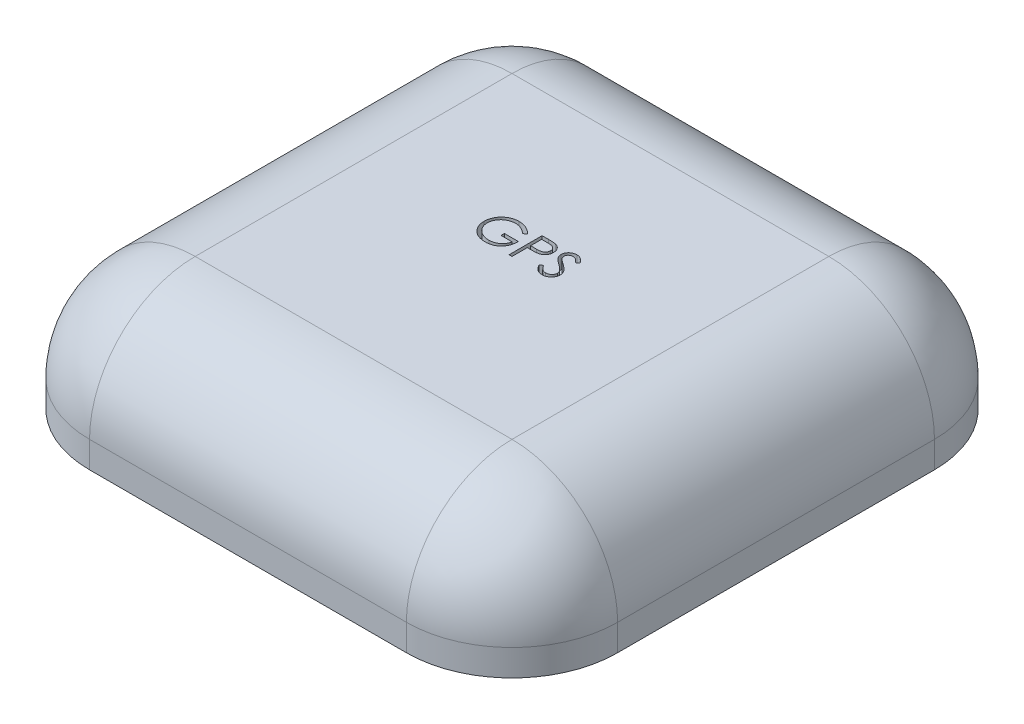
from build123d import *

# Parameters (mm, degrees)
SKETCH1_W           = 50.8
SKETCH1_H           = 50.8
BOSS_EXTRUDE1_DEPTH = 12.7
FILLET1_R           = 10.16
CUT_EXTRUDE1_DEPTH  = 1.27


with BuildPart() as part:
    # Sketch1 → Boss-Extrude1 (new body)
    with BuildSketch(Plane(origin=(0, 0, 0), x_dir=(1, 0, 0), z_dir=(0, 1, 0))):
        Rectangle(SKETCH1_W, SKETCH1_H)
    extrude(amount=BOSS_EXTRUDE1_DEPTH)

    # Fillet1
    fillet1_edges = [part.edges().sort_by_distance(p)[0] for p in [
        (-25.4, 12.7, 0),
        (0, 12.7, 25.4),
        (25.4, 12.7, 0),
        (0, 12.7, -25.4),
        (25.4, 6.35, 25.4),
        (-25.4, 6.35, 25.4),
        (-25.4, 6.35, -25.4),
        (25.4, 6.35, -25.4),
    ]]
    fillet(fillet1_edges, radius=FILLET1_R)

    # Sketch2 → Cut-Extrude1 (cut)
    # profile 1 of 3: a face of its own
    with BuildSketch(Plane(origin=(0, 12.7, 0), x_dir=(1, 0, 0), z_dir=(0, 1, 0))):
        with BuildLine():
            Line((-1.135791938, 2.633112981), (-1.380022707, 2.401602564))
            add(Edge.make_bspline(
                [(-1.380022707, 2.401602564), (-1.424217699, 2.443177704), (-1.511553827, 2.525336601), (-1.65393919, 2.631935861), (-1.802496201, 2.723254395), (-1.95644968, 2.797555052), (-2.111987082, 2.856839342), (-2.267043901, 2.899047012), (-2.420029644, 2.925964242), (-2.521781335, 2.92918312), (-2.571919743, 2.930769231)],
                knots=[0, 0, 0, 0, 1.08915593, 2.152340314, 3.188132944, 4.216796309, 5.218260357, 6.173443236, 7.099959455, 8, 8, 8, 8], degree=3))
            add(Edge.make_bspline(
                [(-2.571919743, 2.930769231), (-2.60268522, 2.930394031), (-2.664136384, 2.929644605), (-2.755414862, 2.920079495), (-2.845736026, 2.906322797), (-2.934929373, 2.88641838), (-3.023168326, 2.86119159), (-3.110145992, 2.829636205), (-3.196024621, 2.792846805), (-3.27999528, 2.750335847), (-3.361402737, 2.703636272), (-3.438289295, 2.651885096), (-3.511145021, 2.596740979), (-3.57860055, 2.536823305), (-3.641043898, 2.47267482), (-3.69996135, 2.405488821), (-3.753280754, 2.33342973), (-3.801442025, 2.257823341), (-3.844405779, 2.179997569), (-3.8823322, 2.1007015), (-3.914170273, 2.020198146), (-3.939361136, 1.93838649), (-3.960144372, 1.855899455), (-3.974765344, 1.772165887), (-3.983008299, 1.687096129), (-3.984434128, 1.630130045), (-3.985150913, 1.601492388)],
                knots=[0, 0, 0, 0, 1.02818874, 2.053710826, 3.065248034, 4.081641283, 5.106893873, 6.131558223, 7.173050175, 8.228653731, 9.27666206, 10.308777013, 11.325269123, 12.329503258, 13.32196095, 14.316845687, 15.314881793, 16.315733098, 17.311955233, 18.285320748, 19.252783886, 20.203351036, 21.145449891, 22.095197417, 23.042428769, 24, 24, 24, 24], degree=3))
            add(Edge.make_bspline(
                [(-3.985150913, 1.601492388), (-3.984465368, 1.572218146), (-3.983096151, 1.513749602), (-3.974332861, 1.426487836), (-3.958069386, 1.340522078), (-3.93632725, 1.255569843), (-3.909130367, 1.17148564), (-3.87522802, 1.088634006), (-3.835072797, 1.007018008), (-3.788593925, 0.927373027), (-3.737625012, 0.849791427), (-3.680526645, 0.776712433), (-3.619874545, 0.707162899), (-3.553459078, 0.642687027), (-3.483409922, 0.581560207), (-3.407634215, 0.525466555), (-3.327621983, 0.473325596), (-3.243251155, 0.425794467), (-3.155437202, 0.383332438), (-3.065397148, 0.345573618), (-2.972843343, 0.314477362), (-2.878262189, 0.289133511), (-2.781766436, 0.26835967), (-2.682866272, 0.254995206), (-2.582288886, 0.245297095), (-2.51449027, 0.244588008), (-2.480333204, 0.244230769)],
                knots=[0, 0, 0, 0, 0.93586088, 1.869166235, 2.799637598, 3.729985548, 4.670839027, 5.622275134, 6.589130586, 7.576015415, 8.568469353, 9.55398029, 10.53834874, 11.515998671, 12.510579167, 13.508179873, 14.527009472, 15.561807829, 16.601455013, 17.643573243, 18.680854198, 19.719860599, 20.772568776, 21.833555941, 22.908541556, 24, 24, 24, 24], degree=3))
            add(Edge.make_bspline(
                [(-2.480333204, 0.244230769), (-2.439168561, 0.245091263), (-2.358335095, 0.246780984), (-2.239511679, 0.259934818), (-2.125390322, 0.280478695), (-2.016291695, 0.310564901), (-1.912089083, 0.348940378), (-1.812400487, 0.395200478), (-1.718010768, 0.451119539), (-1.628636175, 0.514232975), (-1.546306442, 0.584550002), (-1.472053058, 0.660427472), (-1.407060364, 0.741497075), (-1.350359673, 0.827281326), (-1.303452536, 0.918490281), (-1.264950858, 1.014676963), (-1.235438515, 1.115884634), (-1.223323645, 1.185817757), (-1.217202195, 1.221153846)],
                knots=[0, 0, 0, 0, 1.13008108, 2.219097802, 3.278683437, 4.311054135, 5.322181354, 6.324827112, 7.324222904, 8.330512327, 9.32562643, 10.293043162, 11.24128371, 12.174520618, 13.111833804, 14.052305215, 15.015860969, 16, 16, 16, 16], degree=3))
            Line((-1.217202195, 1.221153846), (-2.275535528, 1.221153846))
            Line((-2.275535528, 1.221153846), (-2.275535528, 1.546794872))
            Line((-2.275535528, 1.546794872), (-0.932266297, 1.546794872))
            add(Edge.make_bspline(
                [(-0.932266297, 1.546794872), (-0.933813745, 1.486100221), (-0.936842381, 1.367309826), (-0.958086683, 1.194072509), (-0.992391662, 1.030449616), (-1.039254945, 0.876268829), (-1.099920378, 0.731748642), (-1.173736886, 0.59674232), (-1.261885881, 0.472122045), (-1.361227496, 0.356870449), (-1.472715315, 0.254064664), (-1.593336849, 0.163707849), (-1.723291384, 0.087596191), (-1.862455995, 0.025674018), (-2.010375103, -0.022653106), (-2.16739099, -0.056917322), (-2.333290728, -0.077445931), (-2.446988999, -0.080068825), (-2.505137892, -0.081410256)],
                knots=[0, 0, 0, 0, 1.140356446, 2.231883559, 3.274166699, 4.278491846, 5.25512956, 6.21435461, 7.1637429, 8.11826594, 9.068280886, 10.0076534, 10.945064095, 11.891975133, 12.864533718, 13.863980011, 14.907571808, 16, 16, 16, 16], degree=3))
            add(Edge.make_bspline(
                [(-2.505137892, -0.081410256), (-2.540979229, -0.080893982), (-2.611669897, -0.079875723), (-2.71607381, -0.072639129), (-2.81759908, -0.061498892), (-2.916230917, -0.044675816), (-3.012332127, -0.02407038), (-3.105422751, 0.00231543), (-3.195857403, 0.03285775), (-3.283775861, 0.067597396), (-3.368380128, 0.107848828), (-3.45004704, 0.152579715), (-3.529228026, 0.201559407), (-3.605383725, 0.25563496), (-3.678910939, 0.314401906), (-3.749335563, 0.377978032), (-3.817051852, 0.446168976), (-3.859470273, 0.494591364), (-3.880844022, 0.518990385)],
                knots=[0, 0, 0, 0, 1.107784379, 2.184907829, 3.233506516, 4.263428166, 5.276301166, 6.270063455, 7.25232949, 8.225834625, 9.190232166, 10.146266622, 11.1027726, 12.066435141, 13.031522626, 14.010570082, 14.99756817, 16, 16, 16, 16], degree=3))
            add(Edge.make_bspline(
                [(-3.880844022, 0.518990385), (-3.911855546, 0.557698763), (-3.973363834, 0.634473), (-4.05253759, 0.757481521), (-4.120030292, 0.884846065), (-4.17479253, 1.016921192), (-4.217553509, 1.153583364), (-4.248220609, 1.29465795), (-4.26618865, 1.440326615), (-4.268777216, 1.538901533), (-4.27008681, 1.588772035)],
                knots=[0, 0, 0, 0, 1.023165419, 2.029347347, 3.013907458, 3.994755782, 4.975994455, 5.96558838, 6.970761222, 8, 8, 8, 8], degree=3))
            add(Edge.make_bspline(
                [(-4.27008681, 1.588772035), (-4.269603994, 1.626115707), (-4.268644498, 1.700328436), (-4.257009923, 1.810507565), (-4.240317208, 1.918730336), (-4.215781666, 2.024908283), (-4.184851483, 2.12911232), (-4.146249392, 2.23139083), (-4.101305093, 2.331804171), (-4.049066822, 2.42966118), (-3.990933062, 2.523663326), (-3.927841076, 2.61343219), (-3.858894953, 2.697332985), (-3.785220621, 2.776428266), (-3.705939066, 2.849724363), (-3.621793017, 2.917899877), (-3.532717627, 2.98104626), (-3.438432664, 3.038168896), (-3.340345407, 3.08948018), (-3.238690978, 3.134464679), (-3.133500406, 3.171642401), (-3.025561765, 3.203187187), (-2.914058032, 3.226514493), (-2.799798367, 3.243431569), (-2.682187194, 3.255007256), (-2.602688796, 3.255938217), (-2.562379478, 3.256410256)],
                knots=[0, 0, 0, 0, 1.008945113, 2.00506715, 2.99143336, 3.967273523, 4.948097931, 5.927297278, 6.919902385, 7.919676788, 8.923139349, 9.905703106, 10.883022732, 11.856032218, 12.825136022, 13.798837087, 14.781400844, 15.773989409, 16.776158564, 17.77167057, 18.775803737, 19.789618931, 20.80898985, 21.851988756, 22.910860228, 24, 24, 24, 24], degree=3))
            add(Edge.make_bspline(
                [(-2.562379478, 3.256410256), (-2.529506214, 3.255884575), (-2.464322395, 3.254842209), (-2.367325481, 3.247617136), (-2.271827817, 3.236165472), (-2.177687807, 3.220538316), (-2.085226032, 3.199253397), (-1.994179092, 3.173782381), (-1.904415005, 3.144126228), (-1.816215093, 3.108757774), (-1.728986308, 3.068613415), (-1.642243639, 3.023425524), (-1.556283466, 2.972421413), (-1.470956718, 2.915449634), (-1.385725333, 2.853488677), (-1.301937407, 2.784766415), (-1.217570451, 2.711992915), (-1.163321662, 2.659666934), (-1.135791938, 2.633112981)],
                knots=[0, 0, 0, 0, 0.985871117, 1.954866573, 2.915460327, 3.869826059, 4.81536089, 5.759505086, 6.70452669, 7.649098992, 8.607881297, 9.583363685, 10.581137262, 11.603961102, 12.659522466, 13.73993555, 14.853081303, 16, 16, 16, 16], degree=3))
        make_face()
    # profile 2 of 3: a face of its own
    with BuildSketch(Plane(origin=(0, 12.7, 0), x_dir=(1, 0, 0), z_dir=(0, 1, 0))):
        with BuildLine():
            Line((-0.280984246, 3.175), (0.341677012, 3.175))
            add(Edge.make_bspline(
                [(0.341677012, 3.175), (0.384504048, 3.174952923), (0.466562552, 3.17486272), (0.584232638, 3.172127915), (0.691102895, 3.16847513), (0.786942883, 3.163411556), (0.872047486, 3.157427506), (0.946031608, 3.149034585), (1.009476777, 3.140271317), (1.047491913, 3.131361898), (1.064829055, 3.127298678)],
                knots=[0, 0, 0, 0, 1.415646017, 2.712440637, 3.8905458, 4.950247383, 5.884950622, 6.709939814, 7.411656543, 8, 8, 8, 8], degree=3))
            add(Edge.make_bspline(
                [(1.064829055, 3.127298678), (1.086776047, 3.121291623), (1.130152876, 3.109419063), (1.192655965, 3.085639471), (1.252122668, 3.057443507), (1.30875701, 3.025308933), (1.361863043, 2.987857028), (1.412233094, 2.946605961), (1.459422648, 2.900603324), (1.503166339, 2.850365081), (1.543338977, 2.796734605), (1.577928046, 2.738911296), (1.606890602, 2.677868471), (1.631731141, 2.613648589), (1.649609525, 2.545712367), (1.663077784, 2.474531849), (1.67162636, 2.400114666), (1.672445113, 2.349260357), (1.672861908, 2.323372396)],
                knots=[0, 0, 0, 0, 0.999701418, 1.975846123, 2.934577507, 3.890451536, 4.834027766, 5.787354733, 6.749476667, 7.726910423, 8.712836071, 9.690891519, 10.682875813, 11.679750201, 12.712814741, 13.765529915, 14.8625177, 16, 16, 16, 16], degree=3))
            add(Edge.make_bspline(
                [(1.672861908, 2.323372396), (1.672479616, 2.297266841), (1.671731635, 2.24618956), (1.66275429, 2.171465674), (1.650661902, 2.100056849), (1.632068147, 2.032121418), (1.607715287, 1.968062827), (1.579147496, 1.906902138), (1.544691008, 1.849679864), (1.505098912, 1.796188264), (1.46105568, 1.74637713), (1.412747658, 1.700607423), (1.360369871, 1.659147059), (1.304088779, 1.62190309), (1.243355702, 1.589739179), (1.179091749, 1.560930767), (1.110738338, 1.536736305), (1.063437629, 1.524009035), (1.03938835, 1.517538061)],
                knots=[0, 0, 0, 0, 1.121902311, 2.195077645, 3.232258892, 4.234102512, 5.217864754, 6.176164875, 7.132989551, 8.084763148, 9.034132444, 9.988522005, 10.94243251, 11.903244335, 12.886203696, 13.894208494, 14.929344452, 16, 16, 16, 16], degree=3))
            add(Edge.make_bspline(
                [(1.03938835, 1.517538061), (1.019497126, 1.513308071), (0.975904351, 1.504037802), (0.904110596, 1.493688702), (0.820521567, 1.484855307), (0.725251356, 1.478232132), (0.618385478, 1.472562155), (0.499866123, 1.468055384), (0.369460639, 1.465579017), (0.278500296, 1.465451298), (0.231009945, 1.465384615)],
                knots=[0, 0, 0, 0, 0.601384939, 1.31797006, 2.144135048, 3.087295005, 4.142315834, 5.309527816, 6.595305764, 8, 8, 8, 8], degree=3))
            Line((0.231009945, 1.465384615), (0.003951652, 1.465384615))
            Line((0.003951652, 1.465384615), (0.003951652, 0))
            Line((0.003951652, 0), (-0.280984246, 0))
            Line((-0.280984246, 0), (-0.280984246, 3.175))
        make_face()
        with BuildLine():
            Line((0.003951652, 2.849358974), (0.003951652, 1.791025641))
            Line((0.003951652, 1.791025641), (0.559831059, 1.784029447))
            add(Edge.make_bspline(
                [(0.559831059, 1.784029447), (0.586972706, 1.784015419), (0.639369096, 1.783988339), (0.715057669, 1.787603506), (0.785278952, 1.791776847), (0.849817245, 1.797887291), (0.908701643, 1.806524432), (0.962030329, 1.815243652), (1.009389793, 1.827857802), (1.064815498, 1.8448423), (1.12657682, 1.873809745), (1.193766668, 1.915855716), (1.250708557, 1.969450359), (1.299983012, 2.029709891), (1.339086201, 2.096746959), (1.367711994, 2.16847378), (1.384531472, 2.244154758), (1.386786805, 2.295941855), (1.387926011, 2.322100361)],
                knots=[0, 0, 0, 0, 1.160613943, 2.240541288, 3.23993089, 4.169200891, 5.011653406, 5.7853311, 6.478053781, 7.106038997, 8.262395093, 9.384106736, 10.481365981, 11.59014053, 12.70357646, 13.786202915, 14.881775077, 16, 16, 16, 16], degree=3))
            add(Edge.make_bspline(
                [(1.387926011, 2.322100361), (1.38678061, 2.347626012), (1.384503695, 2.398367848), (1.367580162, 2.472734295), (1.339141856, 2.543705256), (1.299720516, 2.609902269), (1.251876777, 2.669944969), (1.196269516, 2.722103078), (1.133029629, 2.764032765), (1.074203019, 2.791095813), (1.021950515, 2.80761967), (0.97656438, 2.819181061), (0.925319268, 2.82841179), (0.868198496, 2.835886196), (0.805644797, 2.842284693), (0.737120754, 2.846626258), (0.662885949, 2.849167579), (0.611350646, 2.849293631), (0.584635746, 2.849358974)],
                knots=[0, 0, 0, 0, 1.120700087, 2.227813068, 3.331159281, 4.466773991, 5.599788987, 6.693661531, 7.80175334, 8.91857717, 9.525282508, 10.207424825, 10.974604443, 11.810962634, 12.737642355, 13.736264703, 14.826523623, 16, 16, 16, 16], degree=3))
            Line((0.584635746, 2.849358974), (0.003951652, 2.849358974))
        make_face(mode=Mode.SUBTRACT)
    # profile 3 of 3: a face of its own
    with BuildSketch(Plane(origin=(0, 12.7, 0), x_dir=(1, 0, 0), z_dir=(0, 1, 0))):
        with BuildLine():
            Line((1.998502934, 0.612484976), (2.266902373, 0.773397436))
            add(Edge.make_bspline(
                [(2.266902373, 0.773397436), (2.291865345, 0.731610458), (2.339693437, 0.651548221), (2.419477884, 0.543364142), (2.502148453, 0.451414185), (2.588317349, 0.376233263), (2.677458602, 0.317043201), (2.770154136, 0.275131177), (2.866091579, 0.24899097), (2.931382117, 0.245815892), (2.963977693, 0.244230769)],
                knots=[0, 0, 0, 0, 1.272034388, 2.437168799, 3.508375237, 4.49857839, 5.41946034, 6.295179144, 7.148887113, 8, 8, 8, 8], degree=3))
            add(Edge.make_bspline(
                [(2.963977693, 0.244230769), (2.99181506, 0.245006079), (3.047002704, 0.246543133), (3.128248453, 0.261312147), (3.207153373, 0.284001721), (3.282091209, 0.316496423), (3.352027945, 0.355810621), (3.413356876, 0.403296082), (3.46637585, 0.456460283), (3.509745547, 0.515771691), (3.543019579, 0.57955939), (3.568593812, 0.645033288), (3.582786129, 0.713221918), (3.584924041, 0.759132838), (3.586002934, 0.782301683)],
                knots=[0, 0, 0, 0, 1.095163259, 2.171163733, 3.241058638, 4.321873601, 5.38011039, 6.391990106, 7.366004449, 8.327778327, 9.272591725, 10.192022065, 11.087607919, 12, 12, 12, 12], degree=3))
            add(Edge.make_bspline(
                [(3.586002934, 0.782301683), (3.584665523, 0.808736596), (3.581946763, 0.862474913), (3.558967492, 0.941758884), (3.522818532, 1.020220001), (3.489469563, 1.068753292), (3.472155778, 1.093950321)],
                knots=[0, 0, 0, 0, 0.938893495, 1.908633276, 2.914225137, 4, 4, 4, 4], degree=3))
            add(Edge.make_bspline(
                [(3.472155778, 1.093950321), (3.457940292, 1.112135653), (3.428096658, 1.150313485), (3.376790915, 1.207141663), (3.316587368, 1.2657598), (3.249546286, 1.32840623), (3.173225556, 1.392167303), (3.090015596, 1.460083527), (2.997791953, 1.5295721), (2.933113124, 1.576174356), (2.899739913, 1.600220353)],
                knots=[0, 0, 0, 0, 0.722233717, 1.516239348, 2.393582979, 3.351407094, 4.387010283, 5.505090956, 6.712668013, 8, 8, 8, 8], degree=3))
            add(Edge.make_bspline(
                [(2.899739913, 1.600220353), (2.866335288, 1.624013428), (2.802468188, 1.669503978), (2.713152188, 1.737017435), (2.633283283, 1.798742946), (2.563216461, 1.855261585), (2.502982541, 1.90658102), (2.452106875, 1.952208436), (2.41188547, 1.993377809), (2.389519336, 2.020085312), (2.379477493, 2.032076322)],
                knots=[0, 0, 0, 0, 1.452282411, 2.77665338, 3.964542531, 5.026858415, 5.96415736, 6.766646006, 7.446254459, 8, 8, 8, 8], degree=3))
            add(Edge.make_bspline(
                [(2.379477493, 2.032076322), (2.365441684, 2.050764406), (2.337838382, 2.08751703), (2.301402077, 2.144961722), (2.270432979, 2.203765684), (2.246155721, 2.264086933), (2.225712151, 2.325078618), (2.211961743, 2.387536534), (2.20335169, 2.451180424), (2.202469959, 2.494009814), (2.202028575, 2.51544972)],
                knots=[0, 0, 0, 0, 1.068054152, 2.10047183, 3.106115577, 4.101338837, 5.06977816, 6.043150881, 7.020423561, 8, 8, 8, 8], degree=3))
            add(Edge.make_bspline(
                [(2.202028575, 2.51544972), (2.203212586, 2.549041015), (2.2055553, 2.615505616), (2.225367769, 2.712597869), (2.256639609, 2.805295548), (2.300449971, 2.892680922), (2.356926284, 2.972478633), (2.422282275, 3.045606582), (2.500125552, 3.107082367), (2.585535432, 3.160796163), (2.679022284, 3.202838538), (2.77698546, 3.234553141), (2.879580661, 3.252522968), (2.949070648, 3.255101762), (2.984330257, 3.256410256)],
                knots=[0, 0, 0, 0, 1.005424448, 1.989358655, 2.955360095, 3.929531133, 4.905563448, 5.876582895, 6.856512386, 7.866279853, 8.892233794, 9.918561126, 10.94386622, 12, 12, 12, 12], degree=3))
            add(Edge.make_bspline(
                [(2.984330257, 3.256410256), (3.021744548, 3.255119799), (3.096149632, 3.252553491), (3.205595706, 3.230240016), (3.31097007, 3.193318692), (3.39573646, 3.151418981), (3.462078322, 3.109571197), (3.512672158, 3.071453213), (3.56394156, 3.027570079), (3.616300081, 2.977804906), (3.668860537, 2.921701067), (3.72240324, 2.8596428), (3.777053398, 2.792009352), (3.8122105, 2.743727127), (3.830233703, 2.718975361)],
                knots=[0, 0, 0, 0, 1.286793592, 2.559021753, 3.825965368, 5.121522368, 5.803751409, 6.523245864, 7.299691795, 8.125521123, 9.008227632, 9.944561021, 10.946284179, 12, 12, 12, 12], degree=3))
            Line((3.830233703, 2.718975361), (3.572646563, 2.523717949))
            add(Edge.make_bspline(
                [(3.572646563, 2.523717949), (3.557092753, 2.543755546), (3.527139751, 2.582343275), (3.481665146, 2.636382968), (3.438803872, 2.685746489), (3.396576009, 2.728622712), (3.357211787, 2.767359647), (3.319005613, 2.80052457), (3.282507308, 2.828442431), (3.236499825, 2.858236232), (3.178698752, 2.887769632), (3.106141351, 2.912760581), (3.030316659, 2.927778387), (2.97867335, 2.929764021), (2.952529376, 2.930769231)],
                knots=[0, 0, 0, 0, 1.181633172, 2.275549214, 3.290209073, 4.226197932, 5.078386478, 5.862611352, 6.581680152, 7.217281963, 8.414376989, 9.595101626, 10.782541182, 12, 12, 12, 12], degree=3))
            add(Edge.make_bspline(
                [(2.952529376, 2.930769231), (2.919730245, 2.929670046), (2.85648021, 2.927550371), (2.766681925, 2.904400099), (2.685861007, 2.867949411), (2.616416894, 2.816863681), (2.558598351, 2.756338209), (2.516774113, 2.686688819), (2.49160075, 2.609779068), (2.48852891, 2.556129137), (2.486964472, 2.52880609)],
                knots=[0, 0, 0, 0, 1.14458467, 2.207223713, 3.21896685, 4.227309161, 5.202851033, 6.127160689, 7.046193047, 8, 8, 8, 8], degree=3))
            add(Edge.make_bspline(
                [(2.486964472, 2.52880609), (2.487321094, 2.51179582), (2.488034921, 2.477747465), (2.497990631, 2.427445104), (2.510780736, 2.377269817), (2.531048695, 2.327447189), (2.559029792, 2.277105877), (2.595773773, 2.225379015), (2.642050134, 2.17181068), (2.677498567, 2.136969705), (2.696214272, 2.11857472)],
                knots=[0, 0, 0, 0, 0.858281714, 1.717966888, 2.583508476, 3.4729293, 4.427298488, 5.488583878, 6.674047936, 8, 8, 8, 8], degree=3))
            add(Edge.make_bspline(
                [(2.696214272, 2.11857472), (2.703164231, 2.11237256), (2.719675743, 2.09763765), (2.749861762, 2.073514653), (2.789724157, 2.043757852), (2.838222011, 2.006939358), (2.896249546, 1.964229746), (2.963813144, 1.916175112), (3.040159677, 1.861215445), (3.094335987, 1.822791105), (3.1229821, 1.802473958)],
                knots=[0, 0, 0, 0, 0.420754252, 0.999615792, 1.744751191, 2.668019286, 3.750313428, 4.999500688, 6.413464383, 8, 8, 8, 8], degree=3))
            add(Edge.make_bspline(
                [(3.1229821, 1.802473958), (3.15744075, 1.777399296), (3.22416515, 1.728845689), (3.319104526, 1.655897179), (3.405186766, 1.584552418), (3.482714101, 1.515267017), (3.552452439, 1.448566533), (3.613628086, 1.383648505), (3.666864382, 1.320978021), (3.724176958, 1.240630042), (3.782740123, 1.141950058), (3.833033491, 1.021047656), (3.864745706, 0.899675279), (3.868892723, 0.818098792), (3.870938831, 0.777849559)],
                knots=[0, 0, 0, 0, 1.163667725, 2.253281268, 3.268753668, 4.215851969, 5.092017293, 5.902905408, 6.650798638, 7.335211899, 8.59617414, 9.77448103, 10.901945474, 12, 12, 12, 12], degree=3))
            add(Edge.make_bspline(
                [(3.870938831, 0.777849559), (3.870342713, 0.7493849), (3.869162053, 0.693008344), (3.855590367, 0.610226953), (3.835706099, 0.529826093), (3.805736608, 0.452799584), (3.769157743, 0.377738263), (3.722742647, 0.306611097), (3.668942104, 0.237843864), (3.60722576, 0.173270268), (3.539692692, 0.113991933), (3.46831534, 0.06126057), (3.392976878, 0.017292877), (3.314086006, -0.018585387), (3.2316246, -0.046646507), (3.145620396, -0.066978181), (3.055931625, -0.079456576), (2.994971188, -0.080751759), (2.963977693, -0.081410256)],
                knots=[0, 0, 0, 0, 0.983748083, 1.948392443, 2.894712957, 3.844097841, 4.80183111, 5.778335162, 6.776009319, 7.81870978, 8.863265674, 9.881300176, 10.883814829, 11.87499822, 12.874611388, 13.892143829, 14.928324115, 16, 16, 16, 16], degree=3))
            add(Edge.make_bspline(
                [(2.963977693, -0.081410256), (2.939997061, -0.080946542), (2.892337807, -0.080024952), (2.821844205, -0.071877648), (2.752774721, -0.06035049), (2.685996051, -0.042049726), (2.620647827, -0.019845611), (2.557014265, 0.007494162), (2.495064523, 0.040257623), (2.43445143, 0.07771811), (2.375329143, 0.12131335), (2.318252197, 0.172089307), (2.261347865, 0.228645587), (2.206295726, 0.292518026), (2.151982231, 0.362674716), (2.099478245, 0.439772046), (2.047696973, 0.523390074), (2.015207227, 0.582231974), (1.998502934, 0.612484976)],
                knots=[0, 0, 0, 0, 0.915332311, 1.819136955, 2.706846663, 3.586547465, 4.459518054, 5.340707479, 6.227863349, 7.133153174, 8.059268498, 9.028702269, 10.047606654, 11.120612155, 12.245963614, 13.433783089, 14.680604001, 16, 16, 16, 16], degree=3))
        make_face()
    extrude(amount=-CUT_EXTRUDE1_DEPTH, mode=Mode.SUBTRACT)


solid = part.part
